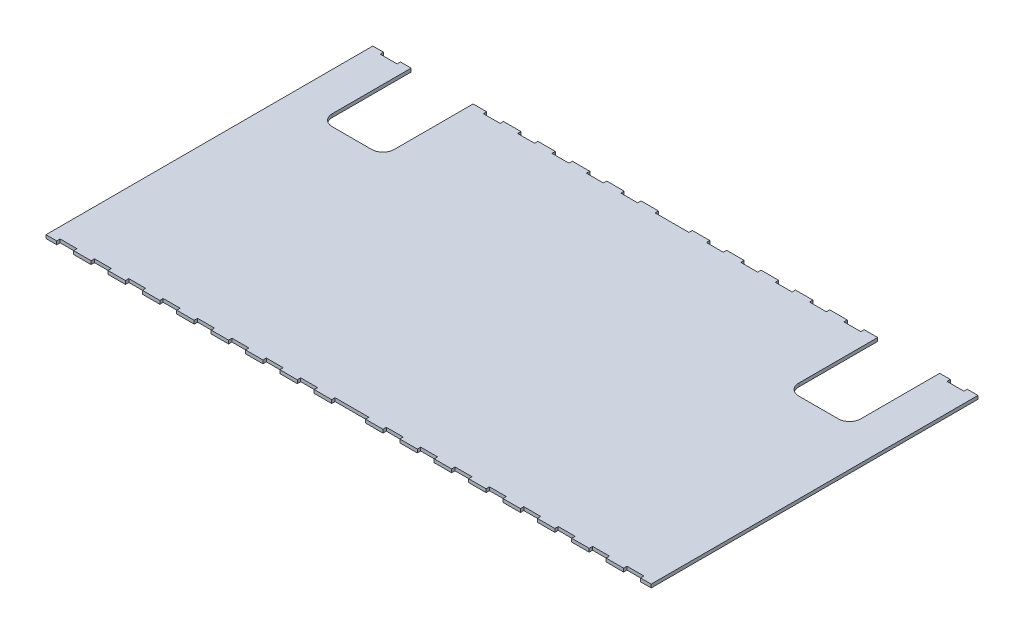
from build123d import *

# Parameters (mm, degrees)
BOSS_EXTRUDE1_DEPTH = 3
FILLET1_R           = 10
SKETCH2_W           = 15
SKETCH2_H           = 3
CUT_EXTRUDE2_DEPTH  = 306.165938466


with BuildPart() as part:
    # Sketch1 → Boss-Extrude1 (new body)
    with BuildSketch(Plane(origin=(0, 0, 0), x_dir=(1, 0, 0), z_dir=(0, 1, 0))):
        Polygon((-234.5, 145), (-268.5, 145), (-268.5, -145), (268.5, -145), (268.5, 145), (234.5, 145), (234.5, 65), (179.5, 65), (179.5, 145), (-179.5, 145), (-179.5, 65), (-234.5, 65), align=None)
    extrude(amount=BOSS_EXTRUDE1_DEPTH)

    # Fillet1
    fillet1_edges = [part.edges().sort_by_distance(p)[0] for p in [
        (-234.5, 1.5, -65),
        (-179.5, 1.5, -65),
        (179.5, 1.5, -65),
        (234.5, 1.5, -65),
    ]]
    fillet(fillet1_edges, radius=FILLET1_R)

    # Sketch2 → Cut-Extrude2 (cut, through all)
    with BuildSketch(Plane(origin=(0, 3, 0), x_dir=(1, 0, 0), z_dir=(0, 1, 0))):
        with Locations((-251.5, 143.5)):
            Rectangle(SKETCH2_W, SKETCH2_H)
        with Locations((-221, 143.5)):
            Rectangle(SKETCH2_W, SKETCH2_H)
        with Locations((-190.5, 143.5)):
            Rectangle(SKETCH2_W, SKETCH2_H)
        with Locations((-160, 143.5)):
            Rectangle(SKETCH2_W, SKETCH2_H)
        with Locations((-129.5, 143.5)):
            Rectangle(SKETCH2_W, SKETCH2_H)
        with Locations((-99, 143.5)):
            Rectangle(SKETCH2_W, SKETCH2_H)
        with Locations((-68.5, 143.5)):
            Rectangle(SKETCH2_W, SKETCH2_H)
        with Locations((-38, 143.5)):
            Rectangle(SKETCH2_W, SKETCH2_H)
        with Locations((-7.5, 143.5)):
            Rectangle(SKETCH2_W, SKETCH2_H)
        with Locations((7.5, 143.5)):
            Rectangle(SKETCH2_W, SKETCH2_H)
        with Locations((38, 143.5)):
            Rectangle(SKETCH2_W, SKETCH2_H)
        with Locations((68.5, 143.5)):
            Rectangle(SKETCH2_W, SKETCH2_H)
        with Locations((99, 143.5)):
            Rectangle(SKETCH2_W, SKETCH2_H)
        with Locations((129.5, 143.5)):
            Rectangle(SKETCH2_W, SKETCH2_H)
        with Locations((160, 143.5)):
            Rectangle(SKETCH2_W, SKETCH2_H)
        with Locations((190.5, 143.5)):
            Rectangle(SKETCH2_W, SKETCH2_H)
        with Locations((221, 143.5)):
            Rectangle(SKETCH2_W, SKETCH2_H)
        with Locations((251.5, 143.5)):
            Rectangle(SKETCH2_W, SKETCH2_H)
        with Locations((-251.5, -143.5)):
            Rectangle(SKETCH2_W, SKETCH2_H)
        with Locations((-221, -143.5)):
            Rectangle(SKETCH2_W, SKETCH2_H)
        with Locations((-190.5, -143.5)):
            Rectangle(SKETCH2_W, SKETCH2_H)
        with Locations((-160, -143.5)):
            Rectangle(SKETCH2_W, SKETCH2_H)
        with Locations((-129.5, -143.5)):
            Rectangle(SKETCH2_W, SKETCH2_H)
        with Locations((-99, -143.5)):
            Rectangle(SKETCH2_W, SKETCH2_H)
        with Locations((-68.5, -143.5)):
            Rectangle(SKETCH2_W, SKETCH2_H)
        with Locations((-38, -143.5)):
            Rectangle(SKETCH2_W, SKETCH2_H)
        with Locations((-7.5, -143.5)):
            Rectangle(SKETCH2_W, SKETCH2_H)
        with Locations((7.5, -143.5)):
            Rectangle(SKETCH2_W, SKETCH2_H)
        with Locations((38, -143.5)):
            Rectangle(SKETCH2_W, SKETCH2_H)
        with Locations((68.5, -143.5)):
            Rectangle(SKETCH2_W, SKETCH2_H)
        with Locations((99, -143.5)):
            Rectangle(SKETCH2_W, SKETCH2_H)
        with Locations((129.5, -143.5)):
            Rectangle(SKETCH2_W, SKETCH2_H)
        with Locations((160, -143.5)):
            Rectangle(SKETCH2_W, SKETCH2_H)
        with Locations((190.5, -143.5)):
            Rectangle(SKETCH2_W, SKETCH2_H)
        with Locations((221, -143.5)):
            Rectangle(SKETCH2_W, SKETCH2_H)
        with Locations((251.5, -143.5)):
            Rectangle(SKETCH2_W, SKETCH2_H)
    extrude(amount=-CUT_EXTRUDE2_DEPTH, mode=Mode.SUBTRACT)


solid = part.part
